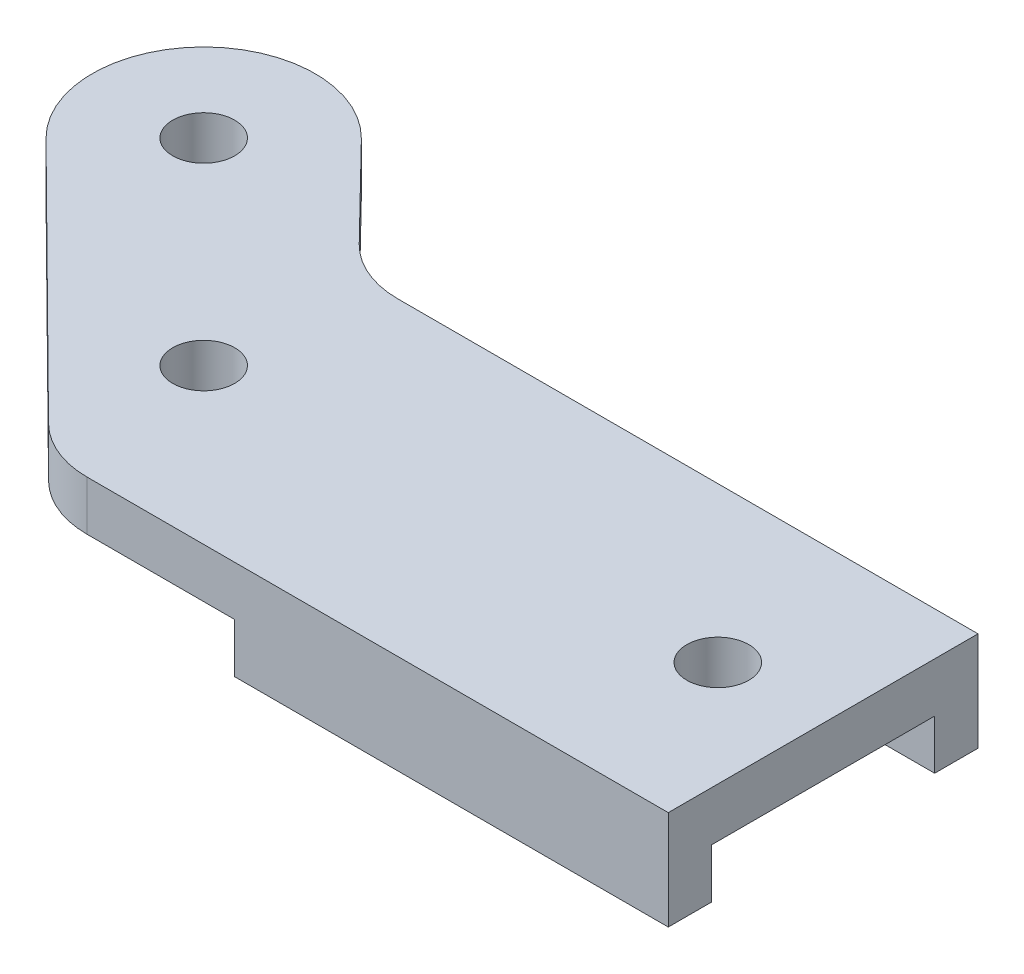
from build123d import *

# Parameters (mm, degrees)
SKETCH1_R           = 5
BOSS_EXTRUDE1_DEPTH = 8
BOSS_EXTRUDE2_DEPTH = 8
FILLET1_R           = 15


with BuildPart() as part:
    # Sketch1 → Boss-Extrude1 (new body)
    with BuildSketch(Plane(origin=(0, 0, 0), x_dir=(1, 0, 0), z_dir=(0, 1, 0))):
        with BuildLine():
            Line((0, -25), (100, -25))
            Line((100, -25), (100, 25))
            Line((100, 25), (0, 25))
            Line((0, 25), (-18.942042706, 44.396101681))
            ThreePointArc((-18.942042706, 44.396101681), (-44.505039362, 44.590272375), (-44.48205564, 19.026548624))
            Line((-44.48205564, 19.026548624), (0, -25))
        make_face()
        with Locations(Location((-31.819805153, 31.819805153, 0), (0, 0, 270))):
            Circle(SKETCH1_R, mode=Mode.SUBTRACT)
        with Locations(Location((0, 0, 0), (0, 0, 270))):
            Circle(SKETCH1_R, mode=Mode.SUBTRACT)
        with Locations(Location((83, 0, 0), (0, 0, 270))):
            Circle(SKETCH1_R, mode=Mode.SUBTRACT)
    extrude(amount=BOSS_EXTRUDE1_DEPTH)

    # Sketch2 → Boss-Extrude2 (add)
    with BuildSketch(Plane.XZ):
        Polygon((100, 25), (30, 25), (30, -25), (100, -25), (100, -18), (50, -18), (50, 18), (100, 18), align=None)
    extrude(amount=BOSS_EXTRUDE2_DEPTH)

    # Fillet1
    fillet1_edges = [part.edges().sort_by_distance(p)[0] for p in [
        (0, 4, -25),
        (0, 4, 25),
    ]]
    fillet(fillet1_edges, radius=FILLET1_R)


solid = part.part
